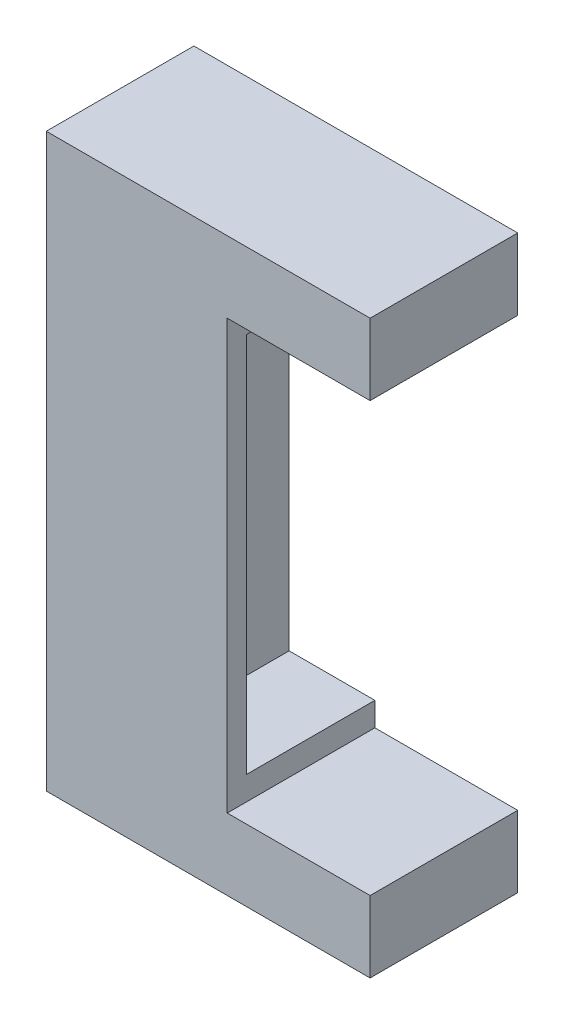
from build123d import *

# Parameters (mm, degrees)
SKETCH1_W           = 6.8
SKETCH1_H           = 12
SKETCH1_W_2         = 2.8
SKETCH1_H_2         = 8
BOSS_EXTRUDE2_DEPTH = 2.7
SKETCH2_W           = 6.8
SKETCH2_H           = 12
BOSS_EXTRUDE3_DEPTH = 0.4
SKETCH3_W           = 3
SKETCH3_H           = 9
CUT_EXTRUDE1_DEPTH  = 26.413775792


with BuildPart() as part:
    # Sketch1 → Boss-Extrude2 (new body)
    with BuildSketch(Plane.XY):
        with Locations((-21.1, 0)):
            Rectangle(SKETCH1_W, SKETCH1_H)
        with Locations((-21.1, 0)):
            Rectangle(SKETCH1_W_2, SKETCH1_H_2, mode=Mode.SUBTRACT)
    extrude(amount=BOSS_EXTRUDE2_DEPTH)

    # Sketch2 → Boss-Extrude3 (add)
    with BuildSketch(Plane.XY.offset(2.7)):
        with Locations((-21.1, 0)):
            Rectangle(SKETCH2_W, SKETCH2_H)
    extrude(amount=BOSS_EXTRUDE3_DEPTH)

    # Sketch3 → Cut-Extrude1 (cut, through all)
    with BuildSketch(Plane.XY.offset(3.1)):
        with Locations((-19.2, 0)):
            Rectangle(SKETCH3_W, SKETCH3_H)
    extrude(amount=-CUT_EXTRUDE1_DEPTH, mode=Mode.SUBTRACT)


solid = part.part
